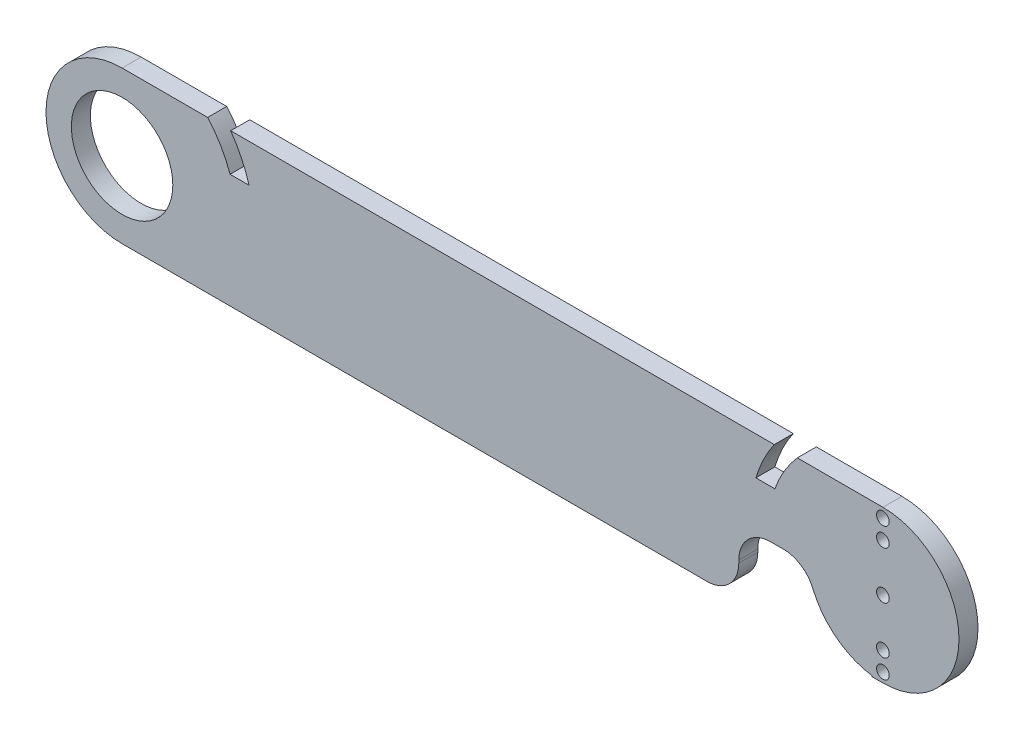
from build123d import *

# Parameters (mm, degrees)
SKETCH1_R           = 8
BOSS_EXTRUDE1_DEPTH = 3
CUT_EXTRUDE1_DEPTH  = 133.578278764
CUT_EXTRUDE8_DEPTH  = 10
FILLET2_R           = 5
FILLET3_R           = 5
FILLET4_R           = 5
SKETCH6_R           = 9.723108926
SKETCH6_R_2         = 1
BOSS_EXTRUDE2_DEPTH = 3
SKETCH10_R          = 1
CUT_EXTRUDE9_DEPTH  = 10


with BuildPart() as part:
    # Sketch1 → Boss-Extrude1 (new body)
    with BuildSketch(Plane.XY):
        with BuildLine():
            Line((0, -12), (-120, -12))
            ThreePointArc((-120, -12), (-132, 0), (-120, 12))
            Line((-120, 12), (0, 12))
            ThreePointArc((0, 12), (12, 0), (0, -12))
        make_face()
        with Locations((-120, 0)):
            Circle(SKETCH1_R, mode=Mode.SUBTRACT)
        with Locations(Location((0, 0, 0), (0, 0, 180))):
            Circle(SKETCH1_R, mode=Mode.SUBTRACT)
    extrude(amount=BOSS_EXTRUDE1_DEPTH)

    # Sketch2 → Cut-Extrude1 (cut, through all)
    with BuildSketch(Plane.XY.offset(3)):
        with BuildLine():
            Line((-17.036725037, 6), (-20.036725037, 6))
            ThreePointArc((-20.036725037, 6), (-18.824439071, 9.116514898), (-17.130976336, 12))
            Line((-17.130976336, 12), (-13.5, 12))
            ThreePointArc((-13.5, 12), (-15.560298648, 9.172082969), (-17.036725037, 6))
        make_face()
        with BuildLine():
            Line((-102.963274963, 6), (-99.963274963, 6))
            ThreePointArc((-99.963274963, 6), (-101.175560929, 9.116514898), (-102.869023664, 12))
            Line((-102.869023664, 12), (-106.5, 12))
            ThreePointArc((-106.5, 12), (-104.439701352, 9.172082969), (-102.963274963, 6))
        make_face()
    extrude(amount=-CUT_EXTRUDE1_DEPTH, mode=Mode.SUBTRACT)

    # Sketch5 → Cut-Extrude8 (cut)
    with BuildSketch(Plane.XY.offset(3)):
        with BuildLine():
            Line((-1.731193523, -11.858337769), (-1.731193523, -12))
            Line((-1.731193523, -12), (-22.731193523, -12))
            Line((-22.731193523, -12), (-22.731193523, -2.344249067))
            Line((-22.731193523, -2.344249067), (-22.731193523, -1.572214532))
            Line((-22.731193523, -1.572214532), (-11.880460729, -1.572214532))
            ThreePointArc((-11.880460729, -1.572214532), (-8.530554828, -8.417056492), (-1.731193523, -11.858337769))
        make_face()
    extrude(amount=-CUT_EXTRUDE8_DEPTH, mode=Mode.SUBTRACT)

    # Fillet2
    fillet2_edges = [part.edges().sort_by_distance(p)[0] for p in [
        (-22.731193523, -1.572214532, 1.5),
    ]]
    fillet(fillet2_edges, radius=FILLET2_R)

    # Fillet3
    fillet3_edges = [part.edges().sort_by_distance(p)[0] for p in [
        (-11.880460729, -1.572214532, 1.5),
    ]]
    fillet(fillet3_edges, radius=FILLET3_R)

    # Fillet4
    fillet4_edges = [part.edges().sort_by_distance(p)[0] for p in [
        (-22.731193523, -12, 1.5),
    ]]
    fillet(fillet4_edges, radius=FILLET4_R)

    # Sketch6 → Boss-Extrude2 (add)
    with BuildSketch(Plane.XY.offset(3)):
        Circle(SKETCH6_R)
        Circle(SKETCH6_R_2, mode=Mode.SUBTRACT)
    extrude(amount=-BOSS_EXTRUDE2_DEPTH)

    # Sketch10 → Cut-Extrude9 (cut)
    with BuildSketch(Plane(origin=(0, 0, 0), x_dir=(-1, 0, 0), z_dir=(0, 0, -1))):
        with Locations((0, 10.5)):
            Circle(SKETCH10_R)
        with Locations((0, 7.5)):
            Circle(SKETCH10_R)
        with Locations((0, -7.5)):
            Circle(SKETCH10_R)
        with Locations((0, -10.5)):
            Circle(SKETCH10_R)
    extrude(amount=-CUT_EXTRUDE9_DEPTH, mode=Mode.SUBTRACT)


solid = part.part
